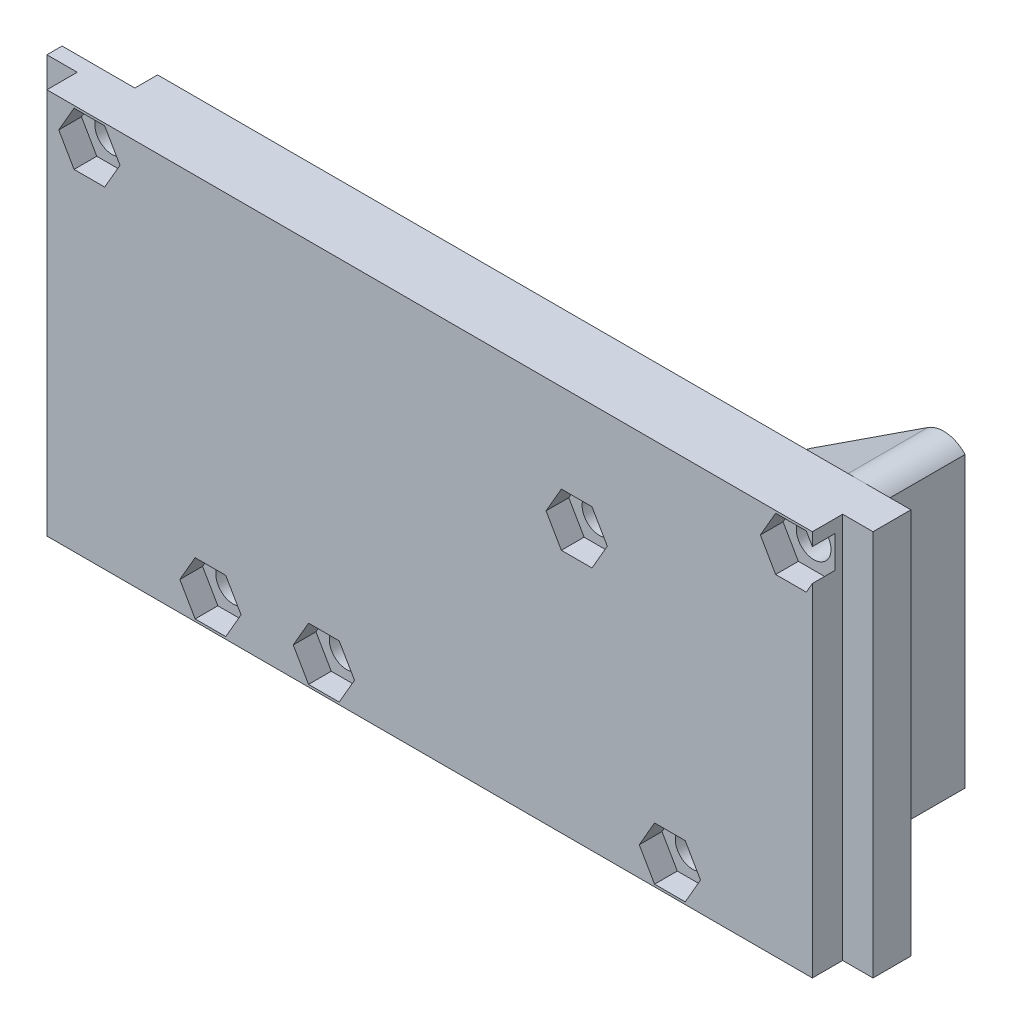
from build123d import *

# Parameters (mm, degrees)
SKETCH2_W            = 109
SKETCH2_H            = 6
BOSS_EXTRUDE2_DEPTH  = 54
BOSS_EXTRUDE18_DEPTH = 3
BOSS_EXTRUDE14_DEPTH = 14.15
CUT_EXTRUDE7_DEPTH   = 23
CUT_EXTRUDE8_DEPTH   = 3
SKETCH33_W           = 6
SKETCH33_H           = 3
CUT_EXTRUDE9_DEPTH   = 123
SKETCH34_W           = 4
SKETCH34_H           = 4
CUT_EXTRUDE10_DEPTH  = 86


with BuildPart() as part:
    # Sketch2 → Boss-Extrude2 (new body)
    with BuildSketch(Plane(origin=(0, 0, 0), x_dir=(1, 0, 0), z_dir=(0, 1, 0))):
        with Locations((0, -61.5)):
            Rectangle(SKETCH2_W, SKETCH2_H)
    extrude(amount=BOSS_EXTRUDE2_DEPTH)

    # Sketch30 → Boss-Extrude18 (add)
    with BuildSketch(Plane(origin=(0, 0, 58.5), x_dir=(-1, 0, 0), z_dir=(0, 0, -1))):
        with BuildLine():
            Line((44.898046307, 54), (-54.5, 54))
            Line((-54.5, 54), (-54.5, 3))
            Line((-54.5, 3), (13.717264207, 3))
            Line((13.717264207, 3), (-4.931615029, 5.361896936))
            ThreePointArc((-4.931615029, 5.361896936), (-14.898890302, 10.119374153), (-20.065130462, 19.881040427))
            Line((-20.065130462, 19.881040427), (-23.157396088, 38.179135111))
            ThreePointArc((-23.157396088, 38.179135111), (-22.149967828, 41.451692308), (-18.921946876, 42.593805718))
            Line((-18.921946876, 42.593805718), (-0.511473267, 40.262103064))
            ThreePointArc((-0.511473267, 40.262103064), (9.455802006, 35.504625847), (14.622042166, 25.742959573))
            Line((14.622042166, 25.742959573), (18.46546266, 3))
            Line((18.46546266, 3), (26.071580329, 3))
            Line((26.071580329, 3), (20.034760857, 23.540167479))
            ThreePointArc((20.034760857, 23.540167479), (20.404648352, 34.578434964), (27.282125622, 43.220221367))
            Line((27.282125622, 43.220221367), (42.812477849, 53.378495603))
            ThreePointArc((42.812477849, 53.378495603), (43.809944346, 53.841319504), (44.898046307, 54))
        make_face()
        with BuildLine():
            Line((54.5, 3), (54.5, 25.946731257))
            Line((54.5, 25.946731257), (54.311662737, 25.932891577))
            ThreePointArc((54.311662737, 25.932891577), (51.728512948, 19.022816741), (46.538874378, 13.779778633))
            Line((46.538874378, 13.779778633), (30.058342822, 3))
            Line((30.058342822, 3), (54.5, 3))
        make_face()
    extrude(amount=BOSS_EXTRUDE18_DEPTH)

    # Sketch26 → Boss-Extrude14 (add)
    with BuildSketch(Plane(origin=(0, 0, 58.5), x_dir=(-1, 0, 0), z_dir=(0, 0, -1))):
        with BuildLine():
            Line((-32.835842822, 3), (-28.849080329, 3))
            Line((-28.849080329, 3), (-22.812260857, 23.540167479))
            ThreePointArc((-22.812260857, 23.540167479), (-23.182148352, 34.578434964), (-30.059625622, 43.220221367))
            Line((-30.059625622, 43.220221367), (-45.589977849, 53.378495603))
            ThreePointArc((-45.589977849, 53.378495603), (-48.161514659, 53.968880093), (-50.5, 52.747061074))
            Line((-50.5, 52.747061074), (-50.5, 14.625881424))
            ThreePointArc((-50.5, 14.625881424), (-49.916939273, 14.190586609), (-49.316374378, 13.779778633))
            Line((-49.316374378, 13.779778633), (-32.835842822, 3))
        make_face()
    extrude(amount=BOSS_EXTRUDE14_DEPTH)

    # Sketch9 → Cut-Extrude7 (cut)
    with BuildSketch(Plane.XY.offset(64.5)):
        with BuildLine():
            ThreePointArc((-42.752881471, 50.979977107), (-45.688023414, 52.335164835), (-47.043211142, 49.400022893))
            ThreePointArc((-47.043211142, 49.400022893), (-44.108069199, 48.044835165), (-42.752881471, 50.979977107))
        make_face()
        with BuildLine():
            ThreePointArc((-31.068118529, 6.020022893), (-28.132976586, 4.664835165), (-26.777788858, 7.599977107))
            ThreePointArc((-26.777788858, 7.599977107), (-29.712930801, 8.955164835), (-31.068118529, 6.020022893))
        make_face()
        with BuildLine():
            ThreePointArc((-15.540189678, 8.459583143), (-15.607157436, 5.227384615), (-12.374958909, 5.160416857))
            ThreePointArc((-12.374958909, 5.160416857), (-12.307991151, 8.392615385), (-15.540189678, 8.459583143))
        make_face()
        with BuildLine():
            ThreePointArc((20.983277975, 37.164416857), (21.050245733, 40.396615385), (17.818047205, 40.463583143))
            ThreePointArc((17.818047205, 40.463583143), (17.751079447, 37.231384615), (20.983277975, 37.164416857))
        make_face()
        with BuildLine():
            ThreePointArc((29.555288858, 7.599977107), (30.910476586, 4.664835165), (33.845618529, 6.020022893))
            ThreePointArc((33.845618529, 6.020022893), (32.490430801, 8.955164835), (29.555288858, 7.599977107))
        make_face()
        with BuildLine():
            ThreePointArc((49.820711142, 49.400022893), (48.465523414, 52.335164835), (45.530381471, 50.979977107))
            ThreePointArc((45.530381471, 50.979977107), (46.885569199, 48.044835165), (49.820711142, 49.400022893))
        make_face()
    extrude(amount=-CUT_EXTRUDE7_DEPTH, mode=Mode.SUBTRACT)

    # Sketch24 → Cut-Extrude8 (cut)
    with BuildSketch(Plane.XY.offset(64.5)):
        Polygon((-40.856594422, 50.19), (-42.877320364, 53.69), (-46.918772249, 53.69), (-48.939498191, 50.19), (-46.918772249, 46.69), (-42.877320364, 46.69), align=None)
        Polygon((51.716998191, 50.19), (49.696272249, 53.69), (45.654820364, 53.69), (43.634094422, 50.19), (45.654820364, 46.69), (49.696272249, 46.69), align=None)
        Polygon((35.741905578, 6.81), (33.721179636, 10.31), (29.679727751, 10.31), (27.659001809, 6.81), (29.679727751, 3.31), (33.721179636, 3.31), align=None)
        Polygon((-9.916122409, 6.81), (-11.936848352, 10.31), (-15.978300236, 10.31), (-17.999026178, 6.81), (-15.978300236, 3.31), (-11.936848352, 3.31), align=None)
        Polygon((23.442114474, 38.814), (21.421388532, 42.314), (17.379936648, 42.314), (15.359210706, 38.814), (17.379936648, 35.314), (21.421388532, 35.314), align=None)
        Polygon((-24.881501809, 6.81), (-26.902227751, 10.31), (-30.943679636, 10.31), (-32.964405578, 6.81), (-30.943679636, 3.31), (-26.902227751, 3.31), align=None)
    extrude(amount=-CUT_EXTRUDE8_DEPTH, mode=Mode.SUBTRACT)

    # Sketch33 → Cut-Extrude9 (cut)
    with BuildSketch(Plane.ZY.offset(54.5)):
        with Locations((61.5, 1.5)):
            Rectangle(SKETCH33_W, SKETCH33_H)
    extrude(amount=-CUT_EXTRUDE9_DEPTH, mode=Mode.SUBTRACT)

    # Sketch34 → Cut-Extrude10 (cut)
    with BuildSketch(Plane(origin=(0, 54, 0), x_dir=(1, 0, 0), z_dir=(0, 1, 0))):
        with Locations((-52.5, -62.5)):
            Rectangle(SKETCH34_W, SKETCH34_H)
        with Locations((52.5, -62.5)):
            Rectangle(SKETCH34_W, SKETCH34_H)
    extrude(amount=-CUT_EXTRUDE10_DEPTH, mode=Mode.SUBTRACT)


solid = part.part
